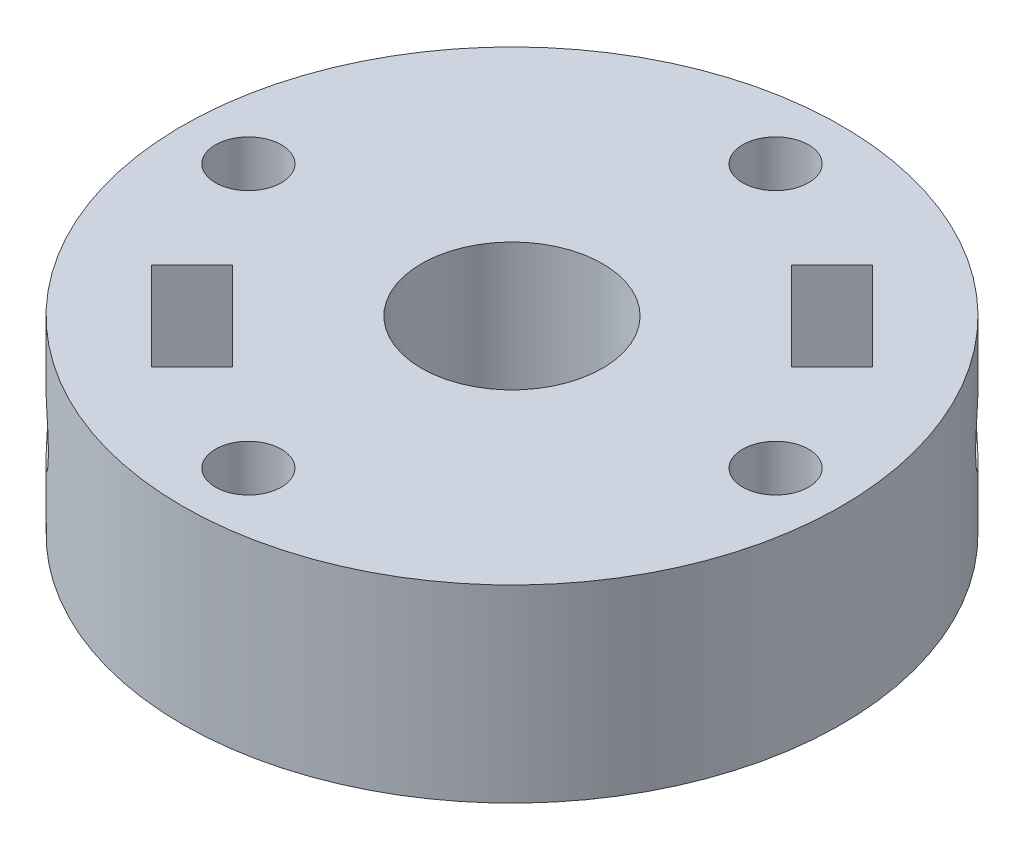
from build123d import *

# Parameters (mm, degrees)
SKETCH1_R               = 15
SKETCH1_R_2             = 4.125
SKETCH1_R_3             = 1.5
BOSS_EXTRUDE1_DEPTH     = 8.6
CUT_EXTRUDE1_DEPTH      = 8.6
CUT_EXTRUDE2_DEPTH      = 8.6
CUT_EXTRUDE2_DEPTH_BACK = 30
SKETCH3_R               = 1.5


with BuildPart() as part:
    # Sketch1 → Boss-Extrude1 (new body)
    with BuildSketch(Plane(origin=(0, 0, 0), x_dir=(1, 0, 0), z_dir=(0, 1, 0))):
        with Locations(Location((0, 0, 0), (0, 0, 90))):
            Circle(SKETCH1_R)
        with Locations(Location((0, 0, 0), (0, 0, 90))):
            Circle(SKETCH1_R_2, mode=Mode.SUBTRACT)
        with Locations(Location((0, 12, 0), (0, 0, 90))):
            Circle(SKETCH1_R_3, mode=Mode.SUBTRACT)
        with Locations(Location((12, 0, 0), (0, 0, 90))):
            Circle(SKETCH1_R_3, mode=Mode.SUBTRACT)
        with Locations(Location((0, -12, 0), (0, 0, 90))):
            Circle(SKETCH1_R_3, mode=Mode.SUBTRACT)
        with Locations(Location((-12, 0, 0), (0, 0, 90))):
            Circle(SKETCH1_R_3, mode=Mode.SUBTRACT)
    extrude(amount=BOSS_EXTRUDE1_DEPTH)

    # Sketch2 → Cut-Extrude1 (cut)
    with BuildSketch(Plane(origin=(0, 8.6, 0), x_dir=(1, 0, 0), z_dir=(0, 1, 0))):
        Polygon((8.202438662, 8.202438662), (6.187184335, 10.217692988), (4.348706704, 8.379215357), (8.379215357, 4.348706704), (10.217692988, 6.187184335), align=None)
        Polygon((-10.217692988, -6.187184335), (-8.379215357, -4.348706704), (-4.348706704, -8.379215357), (-6.187184335, -10.217692988), (-8.202438662, -8.202438662), align=None)
    extrude(amount=-CUT_EXTRUDE1_DEPTH, mode=Mode.SUBTRACT)

    # Sketch3 → Cut-Extrude2 (cut, two sides: drawn at the far end of the back side and taken through both)
    with BuildSketch(Plane(origin=(6.363961031, 0, -6.363961031), x_dir=(-0.7071067811865489, 0, -0.7071067811865461), z_dir=(0.7071067811865461, 0, -0.7071067811865489)).offset(-CUT_EXTRUDE2_DEPTH_BACK)):
        with Locations(Location((0, 4.3, 0), (0, 0, 180))):
            Circle(SKETCH3_R)
    extrude(amount=CUT_EXTRUDE2_DEPTH + CUT_EXTRUDE2_DEPTH_BACK, mode=Mode.SUBTRACT)


solid = part.part
